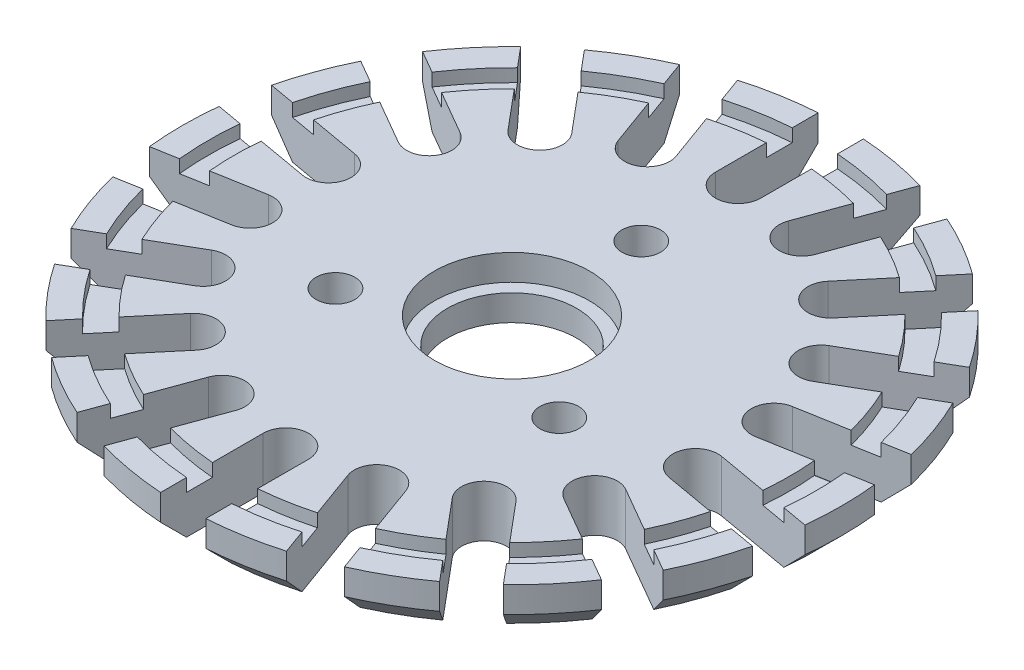
from build123d import *

# Parameters (mm, degrees)
ESBO_O1_R                = 5
RESSALTO_EXTRUS_O1_DEPTH = 4
ESBO_O2_R                = 6
CORTE_EXTRUS_O1_DEPTH    = 2
ESBO_O3_R                = 23.5
ESBO_O3_R_2              = 21.5
CORTE_EXTRUS_O2_DEPTH    = 1
CHANFRO1_SIZE            = 2
ESBO_O4_R                = 1.5
CORTE_EXTRUS_O3_DEPTH    = 37.241378285


with BuildPart() as part:
    # Esboço1 → Ressalto-extrusão1 (new body)
    with BuildSketch(Plane(origin=(0, 0, 0), x_dir=(1, 0, 0), z_dir=(0, 1, 0))):
        with BuildLine():
            Line((1.75, 17.5), (1.75, 25.43988011))
            ThreePointArc((1.75, 25.43988011), (4.428028531, 25.112597702), (7.056489355, 24.504202864))
            Line((7.056489355, 24.504202864), (4.340890422, 17.043156115))
            ThreePointArc((4.340890422, 17.043156115), (5.386817257, 14.800158777), (7.629814595, 15.846085613))
            Line((7.629814595, 15.846085613), (10.345413528, 23.307132362))
            ThreePointArc((10.345413528, 23.307132362), (12.75, 22.083647797), (15.011861951, 20.612957109))
            Line((15.011861951, 20.612957109), (9.908205394, 14.530656072))
            ThreePointArc((9.908205394, 14.530656072), (10.123904853, 12.065199979), (12.589360945, 12.280899438))
            Line((12.589360945, 12.280899438), (17.693017502, 18.363200475))
            ThreePointArc((17.693017502, 18.363200475), (19.5341333, 16.391084047), (21.156582444, 14.235484512))
            Line((21.156582444, 14.235484512), (14.280444566, 10.265544457))
            ThreePointArc((14.280444566, 10.265544457), (13.63990011, 7.875), (16.030444566, 7.234455543))
            Line((16.030444566, 7.234455543), (22.906582444, 11.204395598))
            ThreePointArc((22.906582444, 11.204395598), (23.96216183, 8.721513655), (24.749506857, 6.141002389))
            Line((24.749506857, 6.141002389), (16.930251367, 4.762256677))
            ThreePointArc((16.930251367, 4.762256677), (15.51072211, 2.734958798), (17.538019989, 1.315429541))
            Line((17.538019989, 1.315429541), (25.357275479, 2.694175253))
            ThreePointArc((25.357275479, 2.694175253), (25.5, 0), (25.357275479, -2.694175253))
            Line((25.357275479, -2.694175253), (17.538019989, -1.315429541))
            ThreePointArc((17.538019989, -1.315429541), (15.51072211, -2.734958798), (16.930251367, -4.762256677))
            Line((16.930251367, -4.762256677), (24.749506857, -6.141002389))
            ThreePointArc((24.749506857, -6.141002389), (23.96216183, -8.721513655), (22.906582444, -11.204395598))
            Line((22.906582444, -11.204395598), (16.030444566, -7.234455543))
            ThreePointArc((16.030444566, -7.234455543), (13.63990011, -7.875), (14.280444566, -10.265544457))
            Line((14.280444566, -10.265544457), (21.156582444, -14.235484512))
            ThreePointArc((21.156582444, -14.235484512), (19.5341333, -16.391084047), (17.693017502, -18.363200475))
            Line((17.693017502, -18.363200475), (12.589360945, -12.280899438))
            ThreePointArc((12.589360945, -12.280899438), (10.123904853, -12.065199979), (9.908205394, -14.530656072))
            Line((9.908205394, -14.530656072), (15.011861951, -20.612957109))
            ThreePointArc((15.011861951, -20.612957109), (12.75, -22.083647797), (10.345413528, -23.307132362))
            Line((10.345413528, -23.307132362), (7.629814595, -15.846085613))
            ThreePointArc((7.629814595, -15.846085613), (5.386817257, -14.800158777), (4.340890422, -17.043156115))
            Line((4.340890422, -17.043156115), (7.056489355, -24.504202864))
            ThreePointArc((7.056489355, -24.504202864), (4.428028531, -25.112597702), (1.75, -25.43988011))
            Line((1.75, -25.43988011), (1.75, -17.5))
            ThreePointArc((1.75, -17.5), (0, -15.75), (-1.75, -17.5))
            Line((-1.75, -17.5), (-1.75, -25.43988011))
            ThreePointArc((-1.75, -25.43988011), (-4.428028531, -25.112597702), (-7.056489355, -24.504202864))
            Line((-7.056489355, -24.504202864), (-4.340890422, -17.043156115))
            ThreePointArc((-4.340890422, -17.043156115), (-5.386817257, -14.800158777), (-7.629814595, -15.846085613))
            Line((-7.629814595, -15.846085613), (-10.345413528, -23.307132362))
            ThreePointArc((-10.345413528, -23.307132362), (-12.75, -22.083647797), (-15.011861951, -20.612957109))
            Line((-15.011861951, -20.612957109), (-9.908205394, -14.530656072))
            ThreePointArc((-9.908205394, -14.530656072), (-10.123904853, -12.065199979), (-12.589360945, -12.280899438))
            Line((-12.589360945, -12.280899438), (-17.693017502, -18.363200475))
            ThreePointArc((-17.693017502, -18.363200475), (-19.5341333, -16.391084047), (-21.156582444, -14.235484512))
            Line((-21.156582444, -14.235484512), (-14.280444566, -10.265544457))
            ThreePointArc((-14.280444566, -10.265544457), (-13.63990011, -7.875), (-16.030444566, -7.234455543))
            Line((-16.030444566, -7.234455543), (-22.906582444, -11.204395598))
            ThreePointArc((-22.906582444, -11.204395598), (-23.96216183, -8.721513655), (-24.749506857, -6.141002389))
            Line((-24.749506857, -6.141002389), (-16.930251367, -4.762256677))
            ThreePointArc((-16.930251367, -4.762256677), (-15.51072211, -2.734958798), (-17.538019989, -1.315429541))
            Line((-17.538019989, -1.315429541), (-25.357275479, -2.694175253))
            ThreePointArc((-25.357275479, -2.694175253), (-25.5, 0), (-25.357275479, 2.694175253))
            Line((-25.357275479, 2.694175253), (-17.538019989, 1.315429541))
            ThreePointArc((-17.538019989, 1.315429541), (-15.51072211, 2.734958798), (-16.930251367, 4.762256677))
            Line((-16.930251367, 4.762256677), (-24.749506857, 6.141002389))
            ThreePointArc((-24.749506857, 6.141002389), (-23.96216183, 8.721513655), (-22.906582444, 11.204395598))
            Line((-22.906582444, 11.204395598), (-16.030444566, 7.234455543))
            ThreePointArc((-16.030444566, 7.234455543), (-13.63990011, 7.875), (-14.280444566, 10.265544457))
            Line((-14.280444566, 10.265544457), (-21.156582444, 14.235484512))
            ThreePointArc((-21.156582444, 14.235484512), (-19.5341333, 16.391084047), (-17.693017502, 18.363200475))
            Line((-17.693017502, 18.363200475), (-12.589360945, 12.280899438))
            ThreePointArc((-12.589360945, 12.280899438), (-10.123904853, 12.065199979), (-9.908205394, 14.530656072))
            Line((-9.908205394, 14.530656072), (-15.011861951, 20.612957109))
            ThreePointArc((-15.011861951, 20.612957109), (-12.75, 22.083647797), (-10.345413528, 23.307132362))
            Line((-10.345413528, 23.307132362), (-7.629814595, 15.846085613))
            ThreePointArc((-7.629814595, 15.846085613), (-5.386817257, 14.800158777), (-4.340890422, 17.043156115))
            Line((-4.340890422, 17.043156115), (-7.056489355, 24.504202864))
            ThreePointArc((-7.056489355, 24.504202864), (-4.428028531, 25.112597702), (-1.75, 25.43988011))
            Line((-1.75, 25.43988011), (-1.75, 17.5))
            ThreePointArc((-1.75, 17.5), (0, 15.75), (1.75, 17.5))
        make_face()
        with Locations(Location((0, 0, 0), (0, 0, 270))):
            Circle(ESBO_O1_R, mode=Mode.SUBTRACT)
    extrude(amount=RESSALTO_EXTRUS_O1_DEPTH)

    # Esboço2 → Corte-extrusão1 (cut)
    with BuildSketch(Plane(origin=(0, 4, 0), x_dir=(1, 0, 0), z_dir=(0, 1, 0))):
        with Locations(Location((0, 0, 0), (0, 0, 270))):
            Circle(ESBO_O2_R)
    extrude(amount=-CORTE_EXTRUS_O1_DEPTH, mode=Mode.SUBTRACT)

    # Esboço3 → Corte-extrusão2 (cut)
    with BuildSketch(Plane(origin=(0, 4, 0), x_dir=(1, 0, 0), z_dir=(0, 1, 0))):
        Circle(ESBO_O3_R)
        Circle(ESBO_O3_R_2, mode=Mode.SUBTRACT)
    extrude(amount=-CORTE_EXTRUS_O2_DEPTH, mode=Mode.SUBTRACT)

    # Chanfro1
    chanfro1_edges = [part.edges().sort_by_distance(p)[0] for p in [
        (4.428028531, 0, -25.112597702),
        (12.75, 0, -22.083647797),
        (19.5341333, 0, -16.391084047),
        (23.96216183, 0, -8.721513655),
        (25.5, 0, 0),
        (23.96216183, 0, 8.721513655),
        (19.5341333, 0, 16.391084047),
        (12.75, 0, 22.083647797),
        (4.428028531, 0, 25.112597702),
        (-4.428028531, 0, 25.112597702),
        (-12.75, 0, 22.083647797),
        (-19.5341333, 0, 16.391084047),
        (-23.96216183, 0, 8.721513655),
        (-25.5, 0, 0),
        (-23.96216183, 0, -8.721513655),
        (-19.5341333, 0, -16.391084047),
        (-12.75, 0, -22.083647797),
        (-4.428028531, 0, -25.112597702),
    ]]
    chamfer(chanfro1_edges, length=CHANFRO1_SIZE)

    # Esboço4 → Corte-extrusão3 (cut, through all)
    with BuildSketch(Plane.XZ):
        with Locations(Location((0, -10, 0), (0, 0, 270))):
            Circle(ESBO_O4_R)
        with Locations(Location((-8.660254038, 5, 0), (0, 0, 270))):
            Circle(ESBO_O4_R)
        with Locations(Location((8.660254038, 5, 0), (0, 0, 270))):
            Circle(ESBO_O4_R)
    extrude(amount=-CORTE_EXTRUS_O3_DEPTH, mode=Mode.SUBTRACT)


solid = part.part
